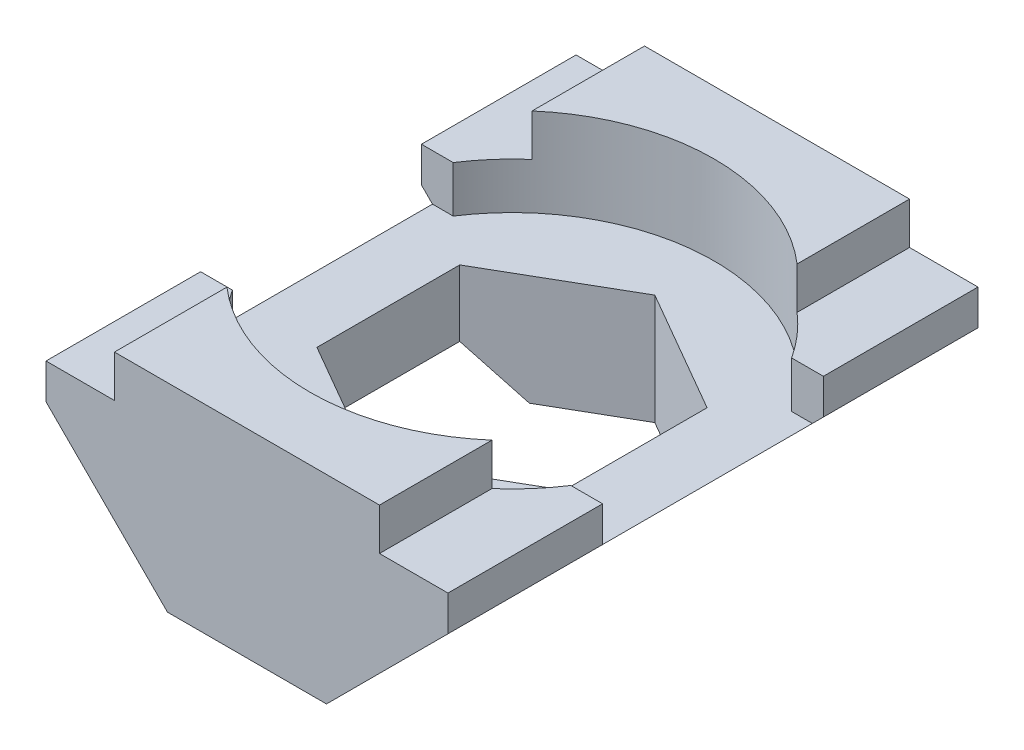
from build123d import *

# Parameters (mm, degrees)
BOSS_EXTRUDE1_DEPTH = 16
SKETCH2_R           = 4.575
CUT_EXTRUDE1_DEPTH  = 2
CUT_EXTRUDE2_DEPTH  = 18.867638344
CUT_EXTRUDE3_START  = -1.05
SKETCH4_W           = 9.1
SKETCH4_H           = 5
CUT_EXTRUDE3_DEPTH  = 1.05
SKETCH5_W           = 9.1
SKETCH5_H           = 2
CUT_EXTRUDE4_DEPTH  = 19.255204737


with BuildPart() as part:
    # Sketch1 → Boss-Extrude1 (new body)
    with BuildSketch(Plane.XY):
        Polygon((0, 0), (0, 0.95), (6, 0.95), (6, 0), (7.55, 0), (7.55, -0.8), (4.8, -3.55), (1.2, -3.55), (-1.55, -0.8), (-1.55, 0), align=None)
    extrude(amount=BOSS_EXTRUDE1_DEPTH)

    # Sketch2 → Cut-Extrude1 (cut)
    with BuildSketch(Plane(origin=(0, 0.95, 0), x_dir=(1, 0, 0), z_dir=(0, 1, 0))):
        with Locations((3, -8)):
            Circle(SKETCH2_R)
    extrude(amount=-CUT_EXTRUDE1_DEPTH, mode=Mode.SUBTRACT)

    # Sketch3 → Cut-Extrude2 (cut, through all)
    with BuildSketch(Plane(origin=(0, -1.05, 0), x_dir=(1, 0, 0), z_dir=(0, 1, 0))):
        Polygon((3, -4.766838493), (0.2, -6.383419246), (0.2, -9.616580754), (3, -11.233161507), (5.8, -9.616580754), (5.8, -6.383419246), align=None)
    extrude(amount=-CUT_EXTRUDE2_DEPTH, mode=Mode.SUBTRACT)

    # Sketch4 → Cut-Extrude3 (cut)
    with BuildSketch(Plane(origin=(0, 0, 0), x_dir=(1, 0, 0), z_dir=(0, 1, 0)).offset(CUT_EXTRUDE3_START)):
        with Locations((3, -8)):
            Rectangle(SKETCH4_W, SKETCH4_H)
    extrude(amount=CUT_EXTRUDE3_DEPTH, mode=Mode.SUBTRACT)

    # Sketch5 → Cut-Extrude4 (cut, through all)
    with BuildSketch(Plane(origin=(0, 0.95, 0), x_dir=(1, 0, 0), z_dir=(0, 1, 0))):
        with Locations((3, -1)):
            Rectangle(SKETCH5_W, SKETCH5_H)
        with Locations((3, -15)):
            Rectangle(SKETCH5_W, SKETCH5_H)
    extrude(amount=-CUT_EXTRUDE4_DEPTH, mode=Mode.SUBTRACT)


solid = part.part
